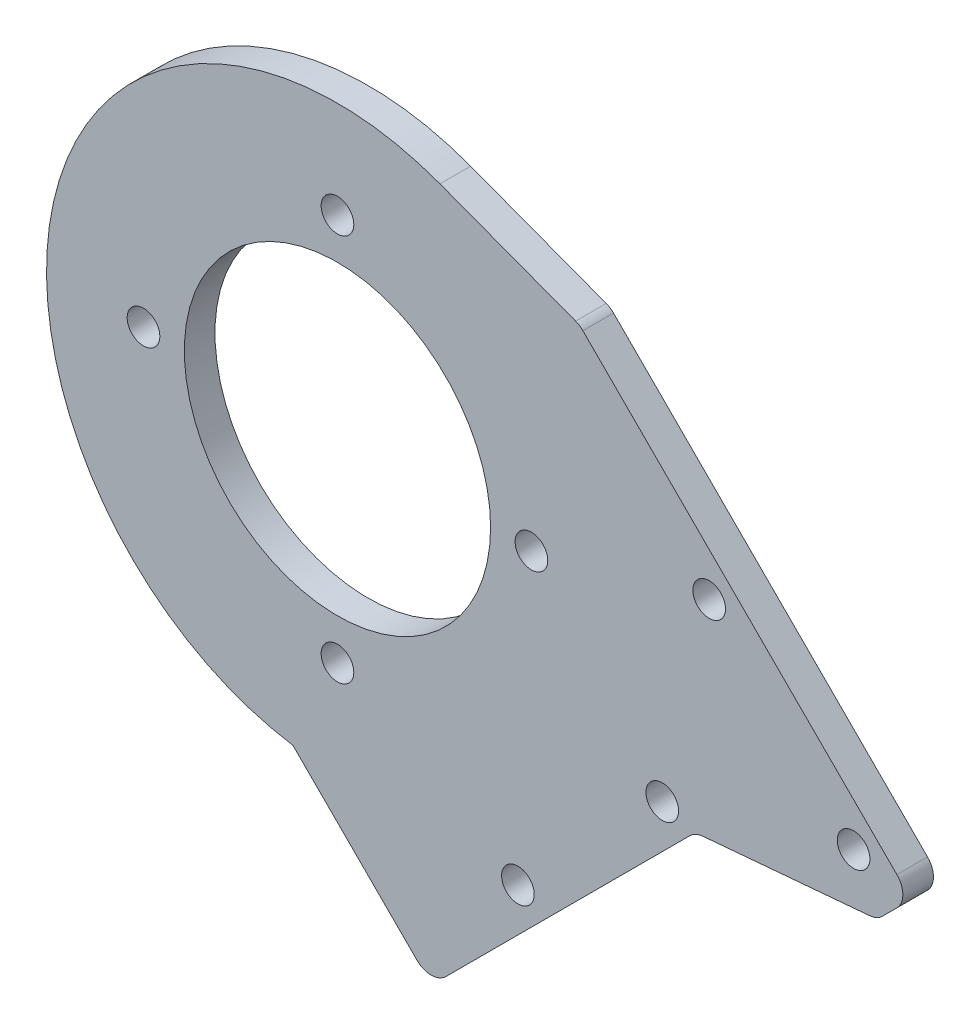
from build123d import *

# Parameters (mm, degrees)
SKETCH_1_R      = 28.5
SKETCH_1_R_2    = 1.6
SKETCH_1_R_3    = 15
EXTRUDE_1_DEPTH = 3
EXTRUDE_START   = -3
SKETCH_2_R      = 1.6
EXTRUDE_2_DEPTH = 3
EXTRUDE_3_DEPTH = 3


with BuildPart() as part:
    # 草图1 → 凸台-拉伸1 (new body)
    with BuildSketch(Plane.XY):
        Circle(SKETCH_1_R)
        with Locations((0, 19)):
            Circle(SKETCH_1_R_2, mode=Mode.SUBTRACT)
        Circle(SKETCH_1_R_3, mode=Mode.SUBTRACT)
        with Locations((19, 0)):
            Circle(SKETCH_1_R_2, mode=Mode.SUBTRACT)
        with Locations((0, -19)):
            Circle(SKETCH_1_R_2, mode=Mode.SUBTRACT)
        with Locations((-19, 0)):
            Circle(SKETCH_1_R_2, mode=Mode.SUBTRACT)
    extrude(amount=EXTRUDE_1_DEPTH)

    # 草图2 → 凸台-拉伸2 (add)
    with BuildSketch(Plane.XY.offset(3).offset(EXTRUDE_START)):
        with BuildLine():
            Line((24.04163056, 21.213203436), (54.800775542, -9.545941546))
            ThreePointArc((54.800775542, -9.545941546), (55.38656198, -10.960155108), (54.800775542, -12.374368671))
            Line((54.800775542, -12.374368671), (53.38656198, -13.788582233))
            ThreePointArc((53.38656198, -13.788582233), (52.817584941, -14.186984245), (52.146659903, -14.366758067))
            Line((52.146659903, -14.366758067), (35.774256751, -15.799157737))
            ThreePointArc((35.774256751, -15.799157737), (35.103331713, -15.978931559), (34.534354674, -16.377333571))
            Line((34.534354674, -16.377333571), (10.606601718, -40.305086528))
            ThreePointArc((10.606601718, -40.305086528), (9.192388155, -40.890872965), (7.778174593, -40.305086528))
            Line((7.778174593, -40.305086528), (-4.362825732, -28.164086203))
            ThreePointArc((-4.362825732, -28.164086203), (25.415604767, -12.895620742), (20.152543264, 20.152543264))
            Line((20.152543264, 20.152543264), (21.213203436, 21.213203436))
            ThreePointArc((21.213203436, 21.213203436), (22.627416998, 21.798989873), (24.04163056, 21.213203436))
        make_face()
        with Locations((50.558134855, -9.545941546)):
            Circle(SKETCH_2_R, mode=Mode.SUBTRACT)
        with Locations((36.415999231, 4.596194078)):
            Circle(SKETCH_2_R, mode=Mode.SUBTRACT)
        with Locations((17.67766953, -28.991378029)):
            Circle(SKETCH_2_R, mode=Mode.SUBTRACT)
        with Locations((31.819805153, -14.849242405)):
            Circle(SKETCH_2_R, mode=Mode.SUBTRACT)
    extrude(amount=EXTRUDE_2_DEPTH)

    # 草图4 → 凸台-拉伸3 (add)
    with BuildSketch(Plane.XY.offset(3).offset(EXTRUDE_START)):
        with BuildLine():
            Line((10.038186091, 26.673672788), (23.33185111, 21.67082656))
            ThreePointArc((23.33185111, 21.67082656), (22.205159437, 21.753906381), (21.213203436, 21.213203436))
            Line((21.213203436, 21.213203436), (20.152543264, 20.152543264))
            ThreePointArc((20.152543264, 20.152543264), (15.443487861, 23.953051636), (10.038186091, 26.673672788))
        make_face()
    extrude(amount=EXTRUDE_3_DEPTH)


solid = part.part
